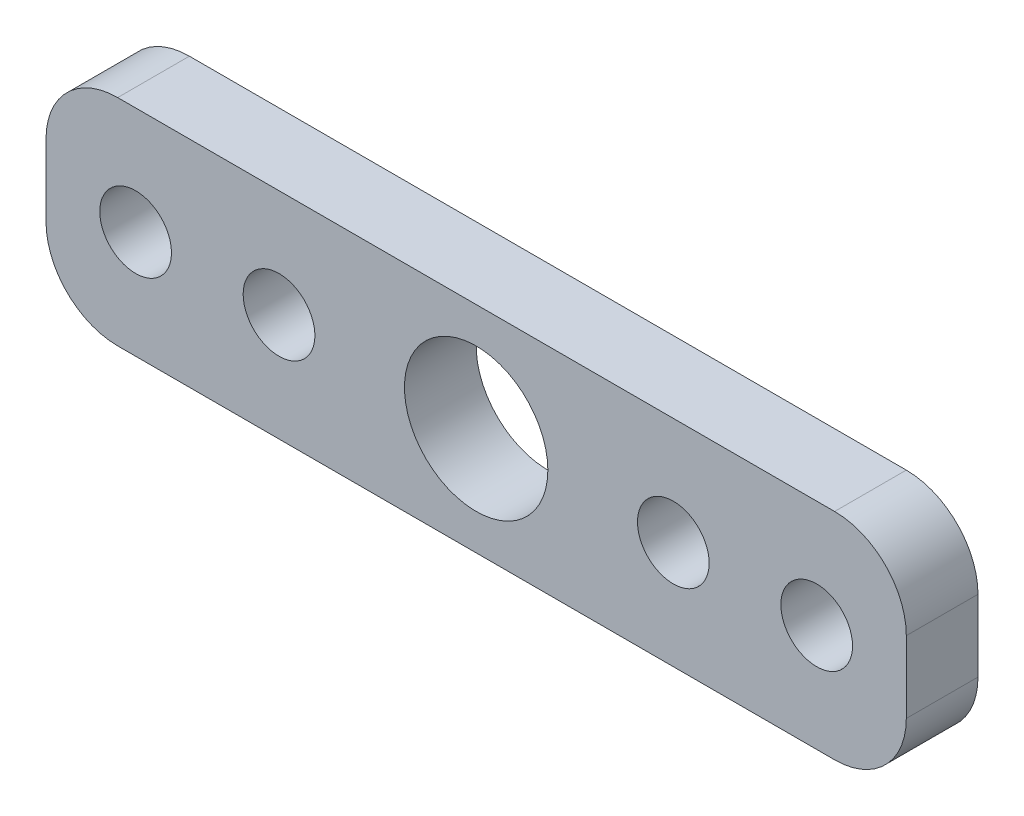
from build123d import *

# Parameters (mm, degrees)
SKETCH1_R           = 2
SKETCH1_R_2         = 1
BOSS_EXTRUDE1_DEPTH = 2


with BuildPart() as part:
    # Sketch1 → Boss-Extrude1 (new body)
    with BuildSketch(Plane.XY):
        with BuildLine():
            Line((-4.75, 417.834574893), (15.25, 417.834574893))
            ThreePointArc((15.25, 417.834574893), (16.664213562, 417.248788455), (17.25, 415.834574893))
            Line((17.25, 415.834574893), (17.25, 413.834574893))
            ThreePointArc((17.25, 413.834574893), (16.664213562, 412.420361331), (15.25, 411.834574893))
            Line((15.25, 411.834574893), (-4.75, 411.834574893))
            ThreePointArc((-4.75, 411.834574893), (-6.164213562, 412.420361331), (-6.75, 413.834574893))
            Line((-6.75, 413.834574893), (-6.75, 415.834574893))
            ThreePointArc((-6.75, 415.834574893), (-6.164213562, 417.248788455), (-4.75, 417.834574893))
        make_face()
        with Locations((5.25, 414.834574893)):
            Circle(SKETCH1_R, mode=Mode.SUBTRACT)
        with Locations((10.75, 414.834574893)):
            Circle(SKETCH1_R_2, mode=Mode.SUBTRACT)
        with Locations((14.75, 414.834574893)):
            Circle(SKETCH1_R_2, mode=Mode.SUBTRACT)
        with Locations(Location((-0.25, 414.834574893, 0), (0, 0, 180))):
            Circle(SKETCH1_R_2, mode=Mode.SUBTRACT)
        with Locations(Location((-4.25, 414.834574893, 0), (0, 0, 180))):
            Circle(SKETCH1_R_2, mode=Mode.SUBTRACT)
    extrude(amount=BOSS_EXTRUDE1_DEPTH)


solid = part.part
